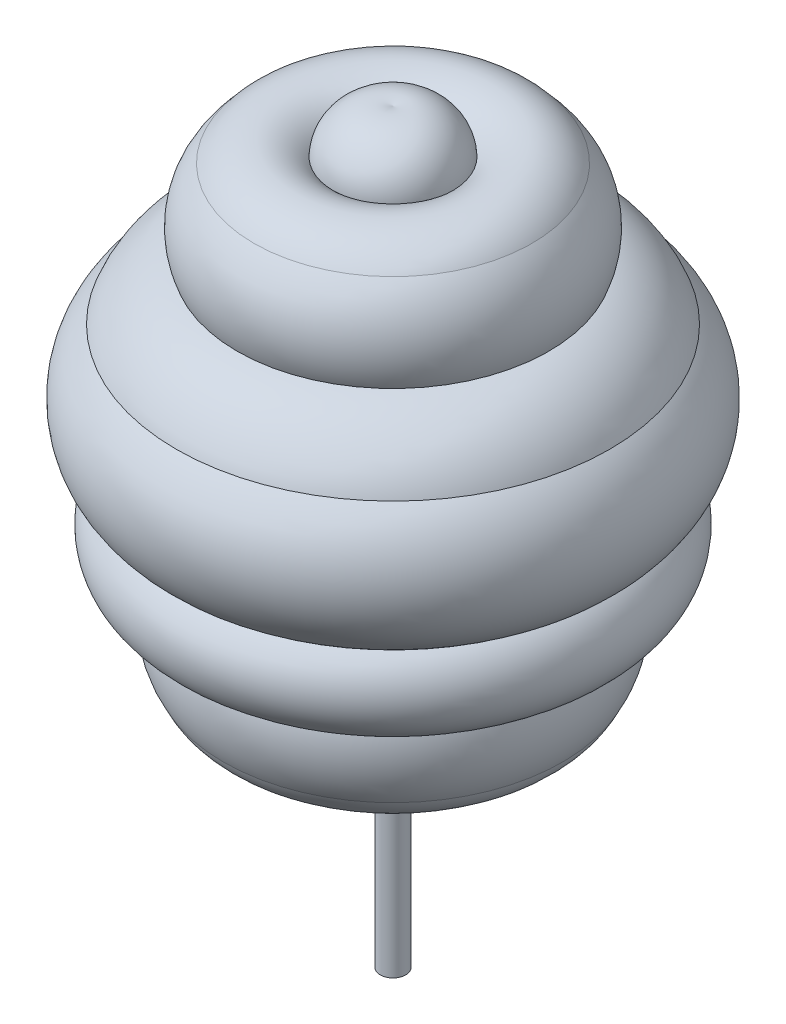
from build123d import *

# Parameters (mm, degrees)
CROQUIS1_R              = 30
SALIENTE_EXTRUIR1_DEPTH = 500
CROQUIS2_R              = 30
SALIENTE_EXTRUIR2_DEPTH = 750
SALIENTE_EXTRUIR2_TAPER = 1.5


with BuildPart() as part:
    # Croquis1 → Saliente-Extruir1 (new, symmetric)
    with BuildSketch(Plane(origin=(0, 0, 0), x_dir=(1, 0, 0), z_dir=(0, 1, 0))):
        with Locations(Location((0, 0, 0), (0, 0, 270))):
            Circle(CROQUIS1_R)
    extrude(amount=SALIENTE_EXTRUIR1_DEPTH, both=True)

    # Croquis2 → Saliente-Extruir2 (add)
    with BuildSketch(Plane(origin=(0, 500, 0), x_dir=(1, 0, 0), z_dir=(0, 1, 0))):
        with Locations(Location((0, 0, 0), (0, 0, 270))):
            Circle(CROQUIS2_R)
    extrude(amount=SALIENTE_EXTRUIR2_DEPTH, taper=SALIENTE_EXTRUIR2_TAPER)

    # Croquis4 → Revolución1 (revolve)
    with BuildSketch(Plane.XY, mode=Mode.PRIVATE) as revoluci_n1_sk:
        with BuildLine():
            Line((0, 0), (139.417105742, 0))
            ThreePointArc((139.417105742, 0), (191.605870122, 14.836634047), (228.184719757, 54.908826362))
            ThreePointArc((228.184719757, 54.908826362), (325.994496208, 49.188399961), (397.650164695, 116.008612632))
            ThreePointArc((397.650164695, 116.008612632), (424.616320703, 200.002484783), (414.570715313, 287.645111062))
            ThreePointArc((414.570715313, 287.645111062), (521.280514057, 363.018963885), (486.319136206, 488.899466332))
            ThreePointArc((486.319136206, 488.899466332), (574.074410714, 642.53731201), (508.351635833, 806.811755216))
            ThreePointArc((508.351635833, 806.811755216), (452.813023709, 888.390082226), (365.608829841, 934.596028231))
            ThreePointArc((365.608829841, 934.596028231), (375.452182418, 1040.082323125), (325.996514487, 1133.775369344))
            ThreePointArc((325.996514487, 1133.775369344), (235.836421233, 1183.523859438), (139.417105742, 1147.370432458))
            ThreePointArc((139.417105742, 1147.370432458), (94.257824082, 1232.034166461), (0, 1250))
            Line((0, 1250), (0, 0))
        make_face()
    revolve(revoluci_n1_sk.sketch.rotate(Axis((0, 1250, 0), (0, -1, 0)), 90), axis=Axis((0, 1250, 0), (0, -1, 0)))


solid = part.part
